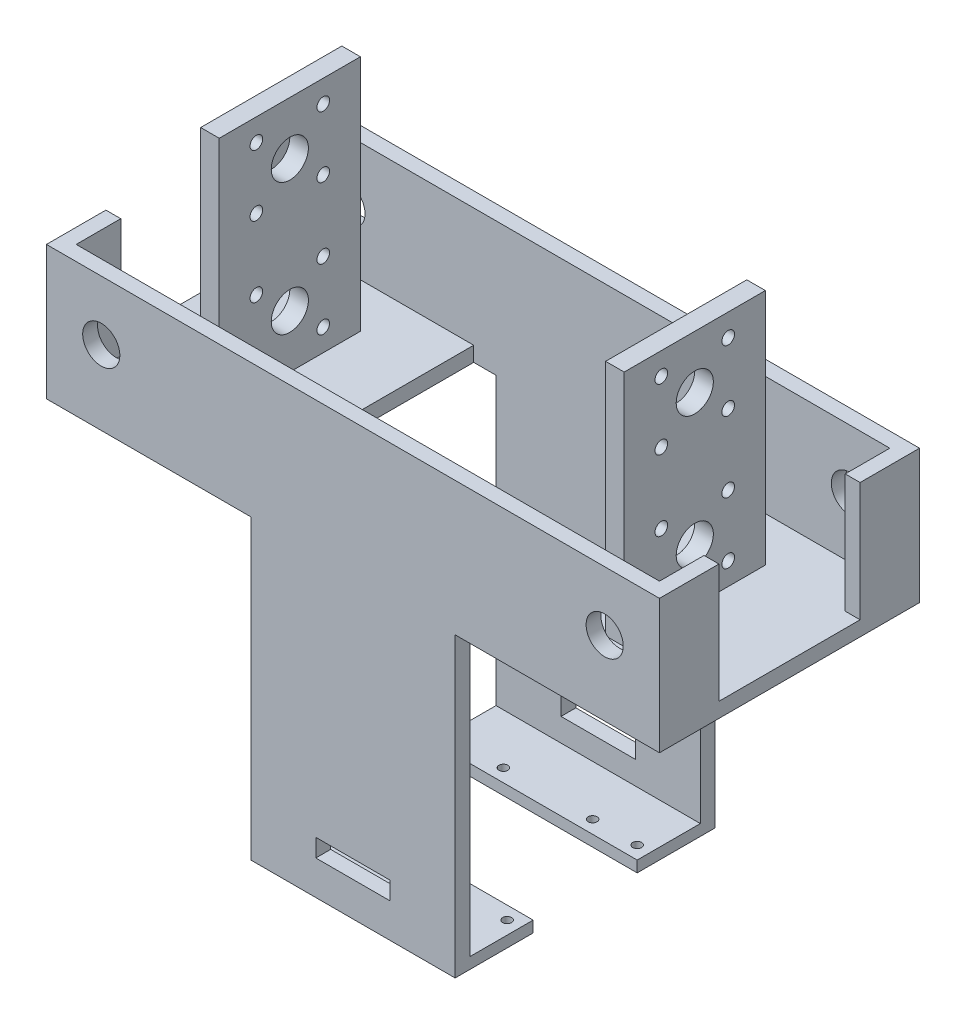
from build123d import *

# Parameters (mm, degrees)
SKETCH1_W                 = 75
SKETCH1_H                 = 40
SKETCH1_R                 = 5
SKETCH1_R_2               = 1.7
SKETCH1_W_2               = 10
SKETCH1_H_2               = 20
BOSS_EXTRUDE1_DEPTH       = 3
CUT_EXTRUDE1_DEPTH        = 43.605750786
CUT_EXTRUDE1_DEPTH_BACK   = 43.605750786
SKETCH2_W                 = 67
SKETCH2_H                 = 28
BOSS_EXTRUDE3_DEPTH       = 110
BOSS_EXTRUDE3_DEPTH_BACK  = 3
SKETCH6_W                 = 67
SKETCH6_H                 = 11
CUT_EXTRUDE4_DEPTH        = 122.372360939
SKETCH7_W                 = 70
SKETCH7_H                 = 37
BOSS_EXTRUDE4_DEPTH       = 45
SKETCH8_W                 = 45
SKETCH8_H                 = 62
CUT_EXTRUDE6_DEPTH        = 29
SKETCH11_W                = 45
SKETCH11_H                = 4
CUT_EXTRUDE9_DEPTH        = 157.445677473
SKETCH9_W                 = 38
SKETCH9_H                 = 28.5
CUT_EXTRUDE10_DEPTH       = 204.024629048
SKETCH13_W                = 5
SKETCH13_H                = 38
BOSS_EXTRUDE5_DEPTH       = 32
SKETCH14_R                = 5
SKETCH14_R_2              = 1.7
CUT_EXTRUDE11_DEPTH       = 32
SKETCH15_W                = 165
SKETCH15_H                = 70
SKETCH15_W_2              = 157
SKETCH15_H_2              = 62
BOSS_EXTRUDE6_DEPTH       = 3
SKETCH16_W                = 20
SKETCH16_H                = 4.820648258
CUT_EXTRUDE12_DEPTH       = 159.626132778
SKETCH18_R                = 5
CUT_EXTRUDE14_DEPTH       = 159.626132778
MIRROR6_COPY_1_SKETCH_W   = 5
MIRROR6_COPY_1_SKETCH_H   = 38
MIRROR6_COPY_1_DEPTH      = 32
MIRROR6_COPY_2_SKETCH_R   = 5
MIRROR6_COPY_2_SKETCH_R_2 = 1.7
MIRROR6_COPY_2_DEPTH      = 32
SKETCH19_W                = 38
SKETCH19_H                = 3.5
CUT_EXTRUDE15_DEPTH       = 10
SKETCH20_R                = 1.2
CUT_EXTRUDE16_DEPTH       = 10
SKETCH21_W                = 10
SKETCH21_H                = 80
CUT_EXTRUDE17_DEPTH       = 184.330984833


with BuildPart() as part:
    # Sketch1 → Boss-Extrude1 (new body)
    with BuildSketch(Plane(origin=(0, 0, 0), x_dir=(1, 0, 0), z_dir=(0, 1, 0))):
        Rectangle(SKETCH1_W, SKETCH1_H)
        with Locations(Location((-21, 0, 0), (0, 0, 270))):
            Circle(SKETCH1_R, mode=Mode.SUBTRACT)
        with Locations(Location((-30, 8.25, 0), (0, 0, 270))):
            Circle(SKETCH1_R_2, mode=Mode.SUBTRACT)
        with Locations(Location((-12, 8.25, 0), (0, 0, 270))):
            Circle(SKETCH1_R_2, mode=Mode.SUBTRACT)
        with Locations(Location((-12, -8.25, 0), (0, 0, 270))):
            Circle(SKETCH1_R_2, mode=Mode.SUBTRACT)
        with Locations(Location((-30, -8.25, 0), (0, 0, 270))):
            Circle(SKETCH1_R_2, mode=Mode.SUBTRACT)
        with Locations(Location((12, 8.25, 0), (0, 0, 90))):
            Circle(SKETCH1_R_2, mode=Mode.SUBTRACT)
        with Locations(Location((12, -8.25, 0), (0, 0, 90))):
            Circle(SKETCH1_R_2, mode=Mode.SUBTRACT)
        with Locations(Location((21, 0, 0), (0, 0, 90))):
            Circle(SKETCH1_R, mode=Mode.SUBTRACT)
        with Locations(Location((30, -8.25, 0), (0, 0, 90))):
            Circle(SKETCH1_R_2, mode=Mode.SUBTRACT)
        with Locations(Location((30, 8.25, 0), (0, 0, 90))):
            Circle(SKETCH1_R_2, mode=Mode.SUBTRACT)
        Rectangle(SKETCH1_W_2, SKETCH1_H_2, mode=Mode.SUBTRACT)
    extrude(amount=BOSS_EXTRUDE1_DEPTH)

    # Sketch2 → Cut-Extrude1 (cut, two sides: drawn at the far end of the back side and taken through both)
    with BuildSketch(Plane(origin=(0, 3, 0), x_dir=(1, 0, 0), z_dir=(0, 1, 0)).offset(-CUT_EXTRUDE1_DEPTH_BACK)):
        Rectangle(SKETCH2_W, SKETCH2_H)
    extrude(amount=CUT_EXTRUDE1_DEPTH + CUT_EXTRUDE1_DEPTH_BACK, mode=Mode.SUBTRACT)

    # Sketch3 → Boss-Extrude3 (add, two sides: drawn at the far end of the back side and taken through both)
    with BuildSketch(Plane(origin=(0, 3, 0), x_dir=(1, 0, 0), z_dir=(0, 1, 0)).offset(-BOSS_EXTRUDE3_DEPTH_BACK)):
        Polygon((37.5, -35), (37.5, -20), (33.5, -20), (-33.5, -20), (-37.5, -20), (-37.5, -35), align=None)
        Polygon((33.5, 20), (37.5, 20), (37.5, 35), (-37.5, 35), (-37.5, 20), (-33.5, 20), align=None)
        Polygon((37.5, -20), (37.5, 20), (33.5, 20), (33.5, 14), (33.5, -14), (33.5, -20), align=None)
        Polygon((-33.5, 14), (-33.5, 20), (-37.5, 20), (-37.5, -20), (-33.5, -20), (-33.5, -14), align=None)
    extrude(amount=BOSS_EXTRUDE3_DEPTH + BOSS_EXTRUDE3_DEPTH_BACK)

    # Sketch6 → Cut-Extrude4 (cut, through all)
    with BuildSketch(Plane(origin=(0, 3, 0), x_dir=(1, 0, 0), z_dir=(0, 1, 0))):
        with Locations((0, -25.5)):
            Rectangle(SKETCH6_W, SKETCH6_H)
        with Locations((0, 25.5)):
            Rectangle(SKETCH6_W, SKETCH6_H)
    extrude(amount=CUT_EXTRUDE4_DEPTH, mode=Mode.SUBTRACT)

    # Sketch7 → Boss-Extrude4 (add)
    with BuildSketch(Plane.ZY.offset(37.5)):
        with Locations((0, 94.5)):
            Rectangle(SKETCH7_W, SKETCH7_H)
    boss_extrude4 = extrude(amount=BOSS_EXTRUDE4_DEPTH)

    # Mirror2: Boss-Extrude4 across plane
    add(boss_extrude4.mirror(Plane(origin=(0, 0, 0), x_dir=(0, 0, 1), z_dir=(1, 0, 0))))

    # Sketch8 → Cut-Extrude6 (cut)
    with BuildSketch(Plane(origin=(0, 113, 0), x_dir=(1, 0, 0), z_dir=(0, 1, 0))):
        with Locations((-56, 0)):
            Rectangle(SKETCH8_W, SKETCH8_H)
        with Locations((56, 0)):
            Rectangle(SKETCH8_W, SKETCH8_H)
    extrude(amount=-CUT_EXTRUDE6_DEPTH, mode=Mode.SUBTRACT)

    # Sketch11 → Cut-Extrude9 (cut, through all)
    with BuildSketch(Plane.XY.offset(35)):
        with Locations((-60, 78)):
            Rectangle(SKETCH11_W, SKETCH11_H)
        with Locations((60, 78)):
            Rectangle(SKETCH11_W, SKETCH11_H)
    extrude(amount=-CUT_EXTRUDE9_DEPTH, mode=Mode.SUBTRACT)

    # Sketch9 → Cut-Extrude10 (cut, through all)
    with BuildSketch(Plane.ZY.offset(82.5)):
        with Locations((0, 98.25)):
            Rectangle(SKETCH9_W, SKETCH9_H)
    extrude(amount=-CUT_EXTRUDE10_DEPTH, mode=Mode.SUBTRACT)

    # Sketch13 → Boss-Extrude5 (add)
    with BuildSketch(Plane(origin=(0, 84, 0), x_dir=(1, 0, 0), z_dir=(0, 1, 0))):
        with Locations((-54.5, 0)):
            Rectangle(SKETCH13_W, SKETCH13_H)
    boss_extrude5 = extrude(amount=BOSS_EXTRUDE5_DEPTH)

    # Sketch14 → Cut-Extrude11 (cut)
    with BuildSketch(Plane.ZY.offset(57)):
        with Locations((0, 98.25)):
            Circle(SKETCH14_R)
        with Locations((-9, 106.5)):
            Circle(SKETCH14_R_2)
        with Locations((9, 106.5)):
            Circle(SKETCH14_R_2)
        with Locations((9, 90)):
            Circle(SKETCH14_R_2)
        with Locations((-9, 90)):
            Circle(SKETCH14_R_2)
    cut_extrude11 = extrude(amount=-CUT_EXTRUDE11_DEPTH, mode=Mode.SUBTRACT)

    # Mirror4: Boss-Extrude5, Cut-Extrude11 across plane
    add(boss_extrude5.mirror(Plane(origin=(0, 0, 0), x_dir=(0, 0, 1), z_dir=(1, 0, 0))))
    add(cut_extrude11.mirror(Plane(origin=(0, 0, 0), x_dir=(0, 0, 1), z_dir=(1, 0, 0))), mode=Mode.SUBTRACT)

    # Sketch15 → Boss-Extrude6 (add)
    with BuildSketch(Plane(origin=(0, 113, 0), x_dir=(1, 0, 0), z_dir=(0, 1, 0))):
        Rectangle(SKETCH15_W, SKETCH15_H)
        Rectangle(SKETCH15_W_2, SKETCH15_H_2, mode=Mode.SUBTRACT)
    extrude(amount=BOSS_EXTRUDE6_DEPTH)

    # Sketch16 → Cut-Extrude12 (cut, through all)
    with BuildSketch(Plane.XY.offset(35)):
        with Locations((0, 11.636111214)):
            Rectangle(SKETCH16_W, SKETCH16_H)
    extrude(amount=-CUT_EXTRUDE12_DEPTH, mode=Mode.SUBTRACT)

    # Sketch18 → Cut-Extrude14 (cut, through all)
    with BuildSketch(Plane.XY.offset(35)):
        with Locations((67.75, 100)):
            Circle(SKETCH18_R)
    cut_extrude14 = extrude(amount=-CUT_EXTRUDE14_DEPTH, mode=Mode.SUBTRACT)

    # Mirror5: Cut-Extrude14 across plane
    add(cut_extrude14.mirror(Plane(origin=(0, 0, 0), x_dir=(0, 0, 1), z_dir=(1, 0, 0))), mode=Mode.SUBTRACT)

    # Mirror6: Boss-Extrude5, Cut-Extrude11 across plane
    add(boss_extrude5.mirror(Plane.ZX.offset(116)))
    add(cut_extrude11.mirror(Plane.ZX.offset(116)), mode=Mode.SUBTRACT)

    # Mirror6 copy 1 sketch → Mirror6 copy 1 (add)
    with BuildSketch(Plane(origin=(0, 148, 0), x_dir=(-1, 0, 0), z_dir=(0, -1, 0))):
        with Locations((-54.5, 0)):
            Rectangle(MIRROR6_COPY_1_SKETCH_W, MIRROR6_COPY_1_SKETCH_H)
    extrude(amount=MIRROR6_COPY_1_DEPTH)

    # Mirror6 copy 2 sketch → Mirror6 copy 2 (cut)
    with BuildSketch(Plane(origin=(57, 232, 0), x_dir=(0, 0, 1), z_dir=(1, 0, 0))):
        with Locations((0, 98.25)):
            Circle(MIRROR6_COPY_2_SKETCH_R)
        with Locations((-9, 106.5)):
            Circle(MIRROR6_COPY_2_SKETCH_R_2)
        with Locations((9, 106.5)):
            Circle(MIRROR6_COPY_2_SKETCH_R_2)
        with Locations((9, 90)):
            Circle(MIRROR6_COPY_2_SKETCH_R_2)
        with Locations((-9, 90)):
            Circle(MIRROR6_COPY_2_SKETCH_R_2)
    extrude(amount=-MIRROR6_COPY_2_DEPTH, mode=Mode.SUBTRACT)

    # Sketch19 → Cut-Extrude15 (cut)
    with BuildSketch(Plane(origin=(82.5, 0, 0), x_dir=(0, 0, -1), z_dir=(1, 0, 0))):
        with Locations((0, 114.25)):
            Rectangle(SKETCH19_W, SKETCH19_H)
    cut_extrude15 = extrude(amount=-CUT_EXTRUDE15_DEPTH, mode=Mode.SUBTRACT)

    # Mirror7: Cut-Extrude15 across plane
    add(cut_extrude15.mirror(Plane(origin=(0, 0, 0), x_dir=(0, 0, 1), z_dir=(1, 0, 0))), mode=Mode.SUBTRACT)

    # Sketch20 → Cut-Extrude16 (cut)
    with BuildSketch(Plane(origin=(0, 3, 0), x_dir=(1, 0, 0), z_dir=(0, 1, 0))):
        with Locations(Location((-24, 17.5, 0), (0, 0, 270))):
            Circle(SKETCH20_R)
        with Locations(Location((-12, 17.5, 0), (0, 0, 270))):
            Circle(SKETCH20_R)
        with Locations(Location((12, 17.5, 0), (0, 0, 270))):
            Circle(SKETCH20_R)
        with Locations(Location((-24, -17.5, 0), (0, 0, 270))):
            Circle(SKETCH20_R)
        with Locations(Location((-12, -17.5, 0), (0, 0, 270))):
            Circle(SKETCH20_R)
        with Locations(Location((24, 17.5, 0), (0, 0, 270))):
            Circle(SKETCH20_R)
        with Locations(Location((12, -17.5, 0), (0, 0, 270))):
            Circle(SKETCH20_R)
        with Locations(Location((24, -17.5, 0), (0, 0, 270))):
            Circle(SKETCH20_R)
    extrude(amount=-CUT_EXTRUDE16_DEPTH, mode=Mode.SUBTRACT)

    # Sketch21 → Cut-Extrude17 (cut, through all)
    with BuildSketch(Plane.XY.offset(35)):
        with Locations((32.5, 40)):
            Rectangle(SKETCH21_W, SKETCH21_H)
        with Locations((-32.5, 40)):
            Rectangle(SKETCH21_W, SKETCH21_H)
    extrude(amount=-CUT_EXTRUDE17_DEPTH, mode=Mode.SUBTRACT)


solid = part.part
